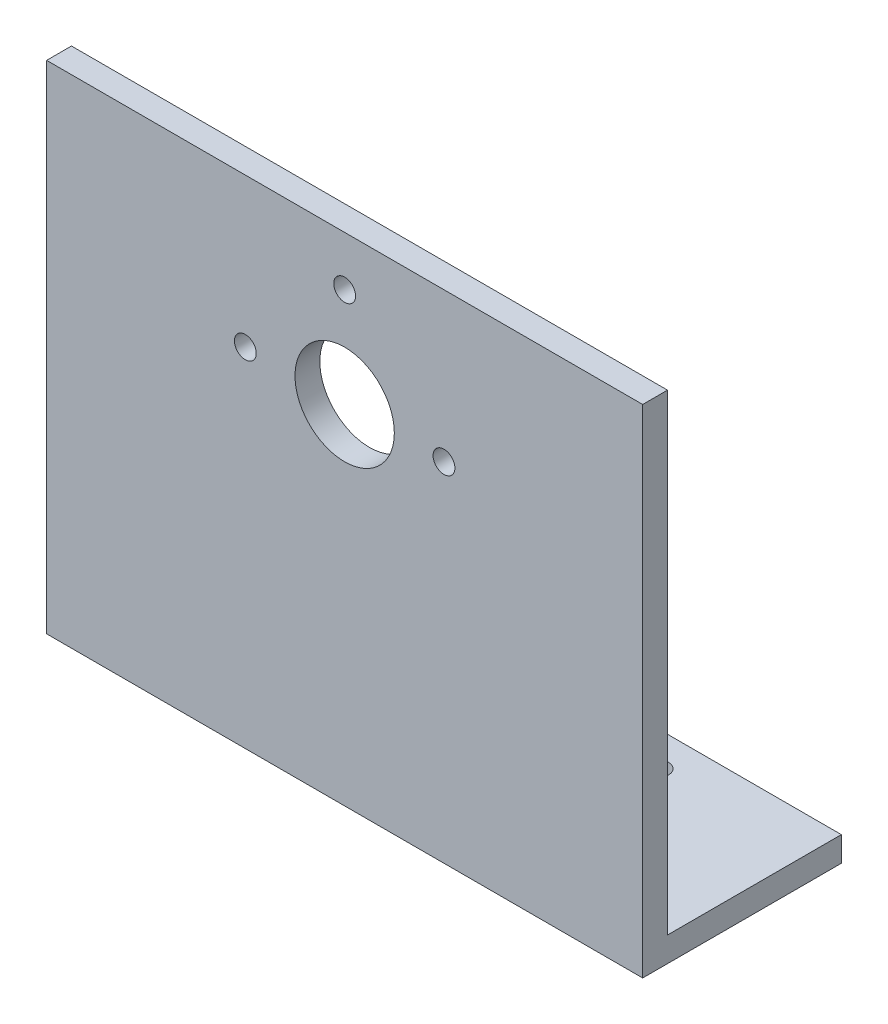
from build123d import *

# Parameters (mm, degrees)
SKETCH1_W           = 76.2
SKETCH1_H           = 63.5
SKETCH1_R           = 6.35
SKETCH1_R_2         = 1.397
BOSS_EXTRUDE1_DEPTH = 3.175
SKETCH2_W           = 76.2
SKETCH2_H           = 3.175
BOSS_EXTRUDE2_DEPTH = 22.225
SKETCH3_R           = 1.397
CUT_EXTRUDE1_DEPTH  = 3175


with BuildPart() as part:
    # Sketch1 → Boss-Extrude1 (new body)
    with BuildSketch(Plane.XY):
        with Locations((0, -12.7)):
            Rectangle(SKETCH1_W, SKETCH1_H)
        Circle(SKETCH1_R, mode=Mode.SUBTRACT)
        with Locations((0, 12.7)):
            Circle(SKETCH1_R_2, mode=Mode.SUBTRACT)
        with Locations((-12.7, 0)):
            Circle(SKETCH1_R_2, mode=Mode.SUBTRACT)
        with Locations((12.7, 0)):
            Circle(SKETCH1_R_2, mode=Mode.SUBTRACT)
    extrude(amount=BOSS_EXTRUDE1_DEPTH)

    # Sketch2 → Boss-Extrude2 (add)
    with BuildSketch(Plane(origin=(0, 0, 0), x_dir=(-1, 0, 0), z_dir=(0, 0, -1))):
        with Locations((0, -42.8625)):
            Rectangle(SKETCH2_W, SKETCH2_H)
    extrude(amount=BOSS_EXTRUDE2_DEPTH)

    # Sketch3 → Cut-Extrude1 (cut)
    with BuildSketch(Plane(origin=(0, -41.275, 0), x_dir=(1, 0, 0), z_dir=(0, 1, 0))):
        with Locations(Location((-19.05, 17.78, 0), (0, 0, 270))):
            Circle(SKETCH3_R)
        with Locations(Location((19.05, 17.78, 0), (0, 0, 270))):
            Circle(SKETCH3_R)
    extrude(amount=-CUT_EXTRUDE1_DEPTH, mode=Mode.SUBTRACT)


solid = part.part
